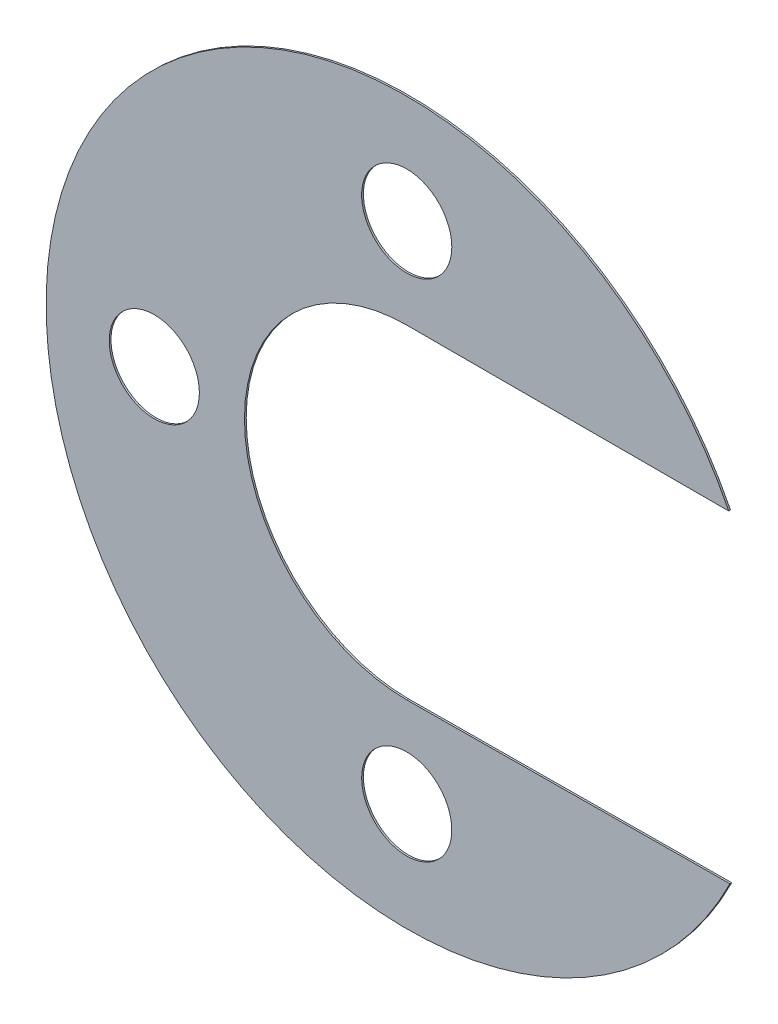
from build123d import *

# Parameters (mm, degrees)
SKETCH1_R           = 127
BOSS_EXTRUDE1_DEPTH = 5


with BuildPart() as part:
    # Sketch1 → Boss-Extrude1 (new body)
    with BuildSketch(Plane.XY):
        with BuildLine():
            Line((-2045.288455612, -640.670506336), (-1137.971443758, -640.670506336))
            ThreePointArc((-1137.971443758, -640.670506336), (-3061.28152044, -1101.624467207), (-1134.61767518, -1548.353280331))
            Line((-1134.61767518, -1548.353280331), (-2045.288455612, -1555.070506336))
            ThreePointArc((-2045.288455612, -1555.070506336), (-2502.488455612, -1097.870506336), (-2045.288455612, -640.670506336))
        make_face()
        with Locations((-2045.288455612, -386.670506336)):
            Circle(SKETCH1_R, mode=Mode.SUBTRACT)
        with Locations((-2756.488455612, -1097.870506336)):
            Circle(SKETCH1_R, mode=Mode.SUBTRACT)
        with Locations(Location((-2045.288455612, -1809.070506336, 0), (0, 0, 180))):
            Circle(SKETCH1_R, mode=Mode.SUBTRACT)
    extrude(amount=BOSS_EXTRUDE1_DEPTH)


solid = part.part
